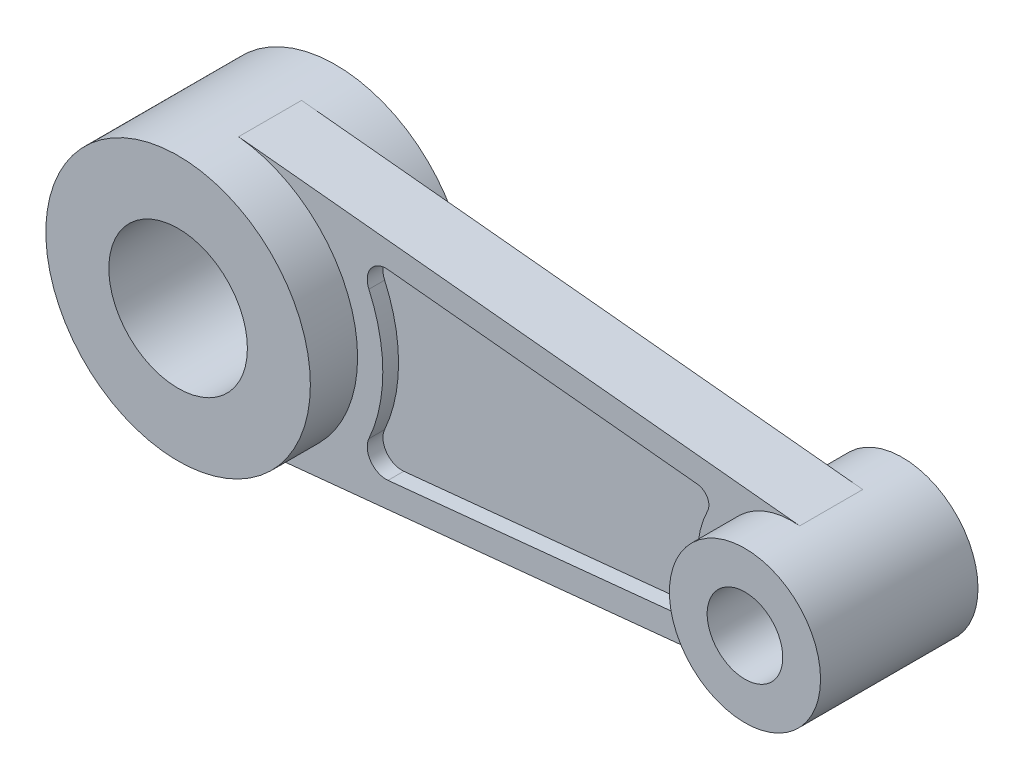
from build123d import *

# Parameters (mm, degrees)
BOSS_EXTRUDE4_DEPTH     = 127
SKETCH12_R              = 533.4
SKETCH12_R_2            = 304.8
BOSS_EXTRUDE5_DEPTH     = 317.5
CUT_EXTRUDE3_DEPTH      = 2665.125832238
CUT_EXTRUDE3_DEPTH_BACK = 2665.125832238
SKETCH13_R              = 279.4
SKETCH13_R_2            = 152.4
CUT_EXTRUDE4_DEPTH      = 63.5
CUT_EXTRUDE5_START      = -63.5
CUT_EXTRUDE5_DEPTH      = 63.5


with BuildPart() as part:
    # Sketch6 → Boss-Extrude4 (new, symmetric)
    with BuildSketch(Plane.XY):
        with BuildLine():
            Line((53.34, 530.726298953), (2316.48, 303.27217083))
            ThreePointArc((2316.48, 303.27217083), (1981.2, 0), (2316.48, -303.27217083))
            Line((2316.48, -303.27217083), (53.34, -530.726298953))
            ThreePointArc((53.34, -530.726298953), (533.4, 0), (53.34, 530.726298953))
        make_face()
    extrude(amount=BOSS_EXTRUDE4_DEPTH, both=True)

    # Sketch12 → Boss-Extrude5 (add, symmetric)
    with BuildSketch(Plane.XY):
        Circle(SKETCH12_R)
        with Locations((2286, 0)):
            Circle(SKETCH12_R_2)
    extrude(amount=BOSS_EXTRUDE5_DEPTH, both=True)

    # Sketch13 → Cut-Extrude3 (cut, two sides: drawn at the far end of the back side and taken through both)
    with BuildSketch(Plane.XY.offset(-CUT_EXTRUDE3_DEPTH_BACK)):
        Circle(SKETCH13_R)
        with Locations((2286, 0)):
            Circle(SKETCH13_R_2)
    extrude(amount=CUT_EXTRUDE3_DEPTH + CUT_EXTRUDE3_DEPTH_BACK, mode=Mode.SUBTRACT)

    # Sketch14 → Cut-Extrude4 (cut)
    with BuildSketch(Plane.XY.offset(127)):
        with BuildLine():
            Line((1904.333401716, 242.58262047), (656.009943133, 368.043848625))
            ThreePointArc((656.009943133, 368.043848625), (586.539592083, 336.733940849), (578.919592083, 260.915898141))
            ThreePointArc((578.919592083, 260.915898141), (635, 0), (578.919592083, -260.915898141))
            ThreePointArc((578.919592083, -260.915898141), (586.539592083, -336.733940849), (656.009943133, -368.043848625))
            Line((656.009943133, -368.043848625), (1904.333401716, -242.58262047))
            ThreePointArc((1904.333401716, -242.58262047), (1943.715352031, -216.609091609), (1944.753001514, -169.444639999))
            ThreePointArc((1944.753001514, -169.444639999), (1905, 0), (1944.753001514, 169.444639999))
            ThreePointArc((1944.753001514, 169.444639999), (1943.715352031, 216.609091609), (1904.333401716, 242.58262047))
        make_face()
    extrude(amount=-CUT_EXTRUDE4_DEPTH, mode=Mode.SUBTRACT)

    # Sketch15 → Cut-Extrude5 (cut)
    with BuildSketch(Plane(origin=(0, 0, -127), x_dir=(-1, 0, 0), z_dir=(0, 0, -1)).offset(CUT_EXTRUDE5_START)):
        with BuildLine():
            Line((-1904.333401716, 242.58262047), (-656.009943133, 368.043848625))
            ThreePointArc((-656.009943133, 368.043848625), (-586.539592083, 336.733940849), (-578.919592083, 260.915898141))
            ThreePointArc((-578.919592083, 260.915898141), (-635, 0), (-578.919592083, -260.915898141))
            ThreePointArc((-578.919592083, -260.915898141), (-586.539592083, -336.733940849), (-656.009943133, -368.043848625))
            Line((-656.009943133, -368.043848625), (-1904.333401716, -242.58262047))
            ThreePointArc((-1904.333401716, -242.58262047), (-1943.715352031, -216.609091609), (-1944.753001514, -169.444639999))
            ThreePointArc((-1944.753001514, -169.444639999), (-1905, 0), (-1944.753001514, 169.444639999))
            ThreePointArc((-1944.753001514, 169.444639999), (-1943.715352031, 216.609091609), (-1904.333401716, 242.58262047))
        make_face()
    extrude(amount=CUT_EXTRUDE5_DEPTH, mode=Mode.SUBTRACT)


solid = part.part
